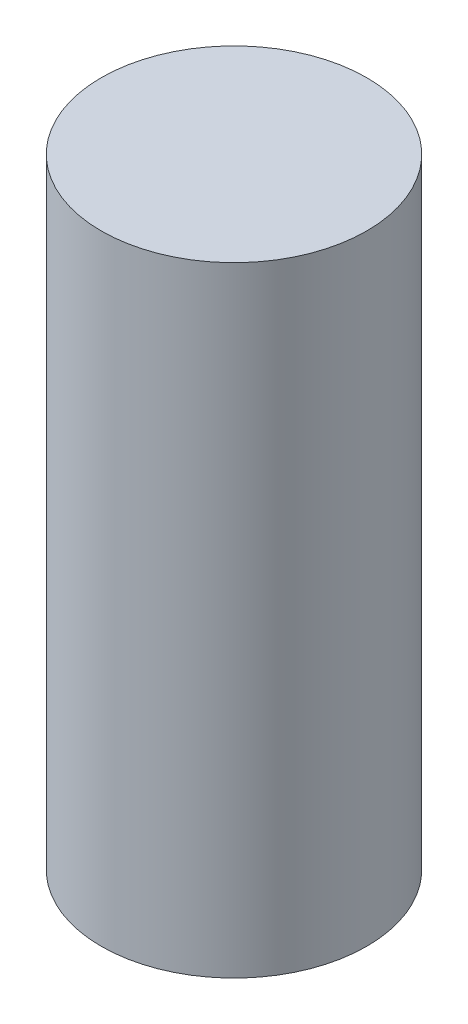
from build123d import *

# Parameters (mm, degrees)
TOPPING_AYAR_MIL_4_START = 12
SKETCH1_R                = 6
TOPPING_AYAR_MIL_4_DEPTH = 28


with BuildPart() as part:
    # Sketch1 → TOPPING_ayar_mil_4 (new body)
    with BuildSketch(Plane(origin=(0, 0, 0), x_dir=(1, 0, 0), z_dir=(0, 1, 0)).offset(TOPPING_AYAR_MIL_4_START)):
        with Locations(Location((650, 770, 0), (0, 0, 270))):
            Circle(SKETCH1_R)
    extrude(amount=TOPPING_AYAR_MIL_4_DEPTH)


solid = part.part
